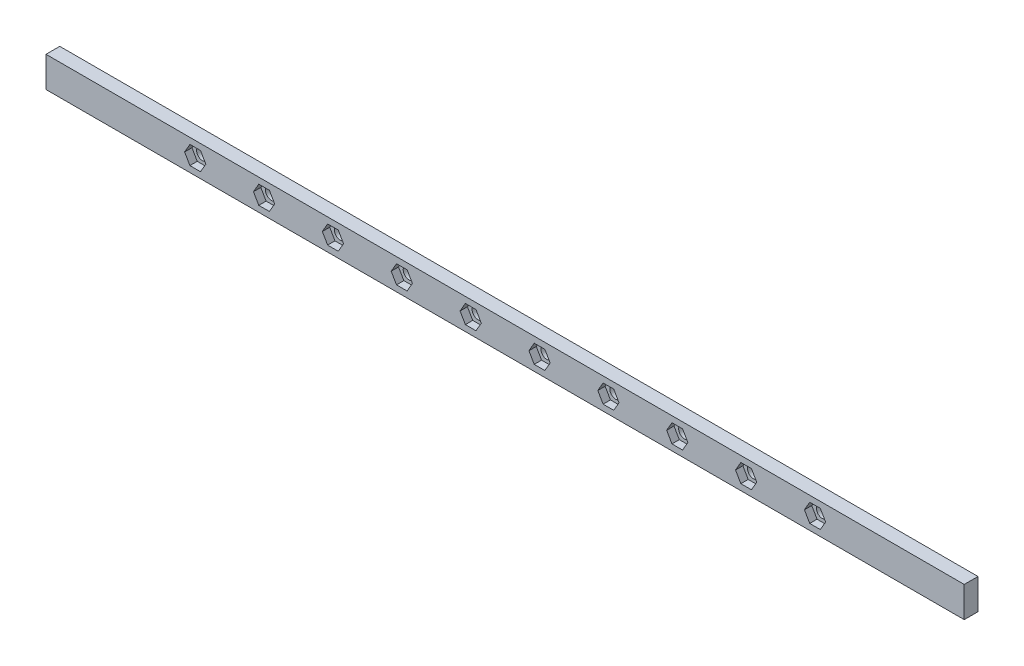
from build123d import *

# Parameters (mm, degrees)
SKETCH2_W                        = 200
SKETCH2_H                        = 6.65
BOSS_EXTRUDE1_DEPTH              = 3
CUT_EXTRUDE1_DEPTH               = 1.6
LPATTERN1_COUNT                  = 5
LPATTERN1_PITCH                  = 15
LPATTERN1_COUNT_DIR2             = 5
LPATTERN1_PITCH_DIR2             = 15
TALADRO_DE_MARGEN_PARA_M21_D     = 2.6
TALADRO_DE_MARGEN_PARA_M21_DEPTH = 12.5
TALADRO_DE_MARGEN_PARA_M21_TIP   = 0.781118805


with BuildPart() as part:
    # Sketch2 → Boss-Extrude1 (new body)
    with BuildSketch(Plane.XY):
        Rectangle(SKETCH2_W, SKETCH2_H)
    extrude(amount=BOSS_EXTRUDE1_DEPTH)

    # Sketch3 → Cut-Extrude1 (cut)
    with BuildSketch(Plane.XY.offset(3)):
        Polygon((-5.190598923, 0), (-6.345299462, 2), (-8.654700538, 2), (-9.809401077, 0), (-8.654700538, -2), (-6.345299462, -2), align=None)
        Polygon((5.190598923, 0), (6.345299462, 2), (8.654700538, 2), (9.809401077, 0), (8.654700538, -2), (6.345299462, -2), align=None)
    cut_extrude1 = extrude(amount=-CUT_EXTRUDE1_DEPTH, mode=Mode.SUBTRACT)

    # LPattern1: Cut-Extrude1 5 × 5
    with Locations(*[Vector(-1, 0, 0) * (i * LPATTERN1_PITCH) + Vector(1, 0, 0) * (j * LPATTERN1_PITCH_DIR2) for i in range(LPATTERN1_COUNT) for j in range(LPATTERN1_COUNT_DIR2) if (i, j) != (0, 0)]):
        add(cut_extrude1, mode=Mode.SUBTRACT)

    # Taladro de margen para M21
    with Locations(Plane.XY.offset(3)):
        with Locations((37.5, 0), (52.5, 0), (67.5, 0), (22.5, 0), (7.5, 0), (-67.5, 0), (-52.5, 0), (-37.5, 0), (-7.5, 0), (-22.5, 0)):
            Hole(TALADRO_DE_MARGEN_PARA_M21_D / 2, depth=TALADRO_DE_MARGEN_PARA_M21_DEPTH)
            with Locations((0, 0, -(TALADRO_DE_MARGEN_PARA_M21_DEPTH + TALADRO_DE_MARGEN_PARA_M21_TIP / 2))):  # 118° drill point
                Cone(0, TALADRO_DE_MARGEN_PARA_M21_D / 2, TALADRO_DE_MARGEN_PARA_M21_TIP, mode=Mode.SUBTRACT)


solid = part.part
